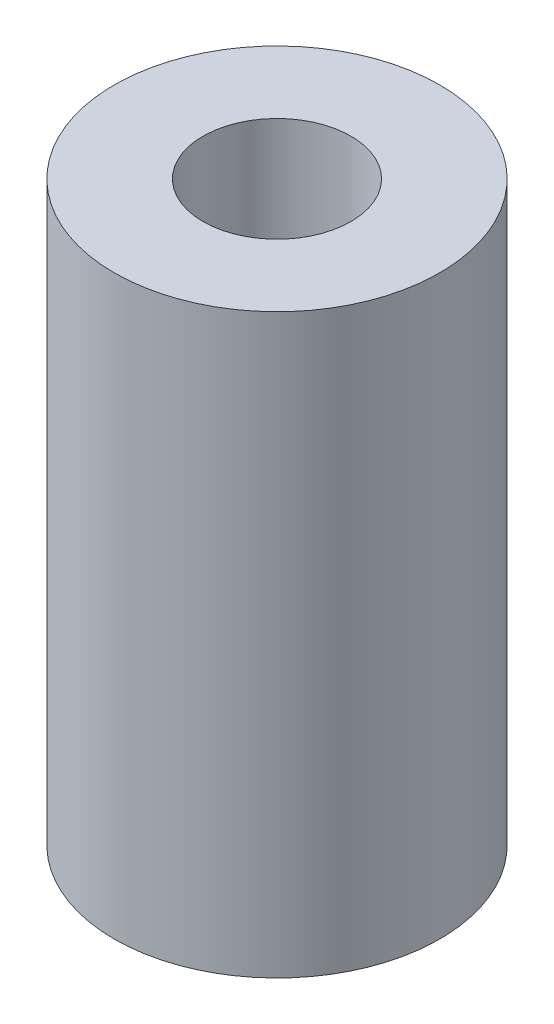
from build123d import *

# Parameters (mm, degrees)
SKETCH1_R           = 2.2
SKETCH1_R_2         = 1
BOSS_EXTRUDE1_DEPTH = 7.8


with BuildPart() as part:
    # Sketch1 → Boss-Extrude1 (new body)
    with BuildSketch(Plane(origin=(0, 0, 0), x_dir=(1, 0, 0), z_dir=(0, 1, 0))):
        with Locations(Location((0, 0, 0), (0, 0, 270))):
            Circle(SKETCH1_R)
        with Locations(Location((0, 0, 0), (0, 0, 270))):
            Circle(SKETCH1_R_2, mode=Mode.SUBTRACT)
    extrude(amount=BOSS_EXTRUDE1_DEPTH)


solid = part.part
